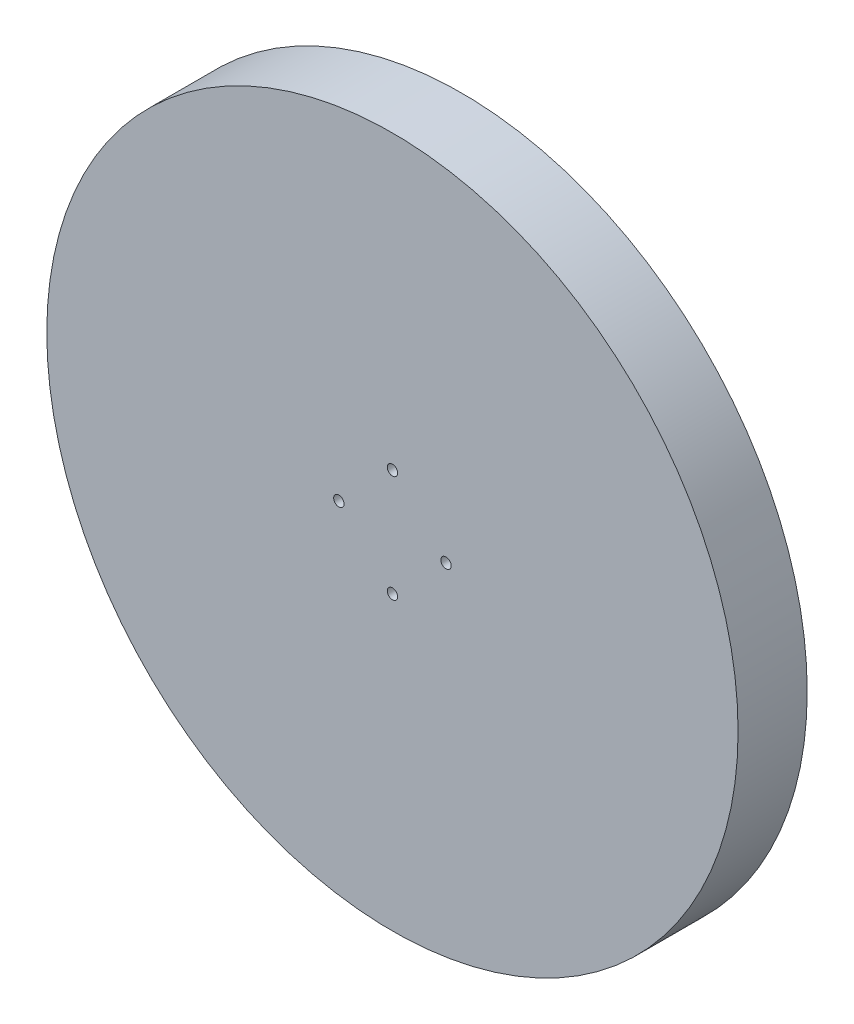
from build123d import *

# Parameters (mm, degrees)
SKETCH_1_R          = 100
EXTRUDE_1_DEPTH     = 20
SKETCH_2_R          = 1.5
CUT_EXTRUDE_1_DEPTH = 20


with BuildPart() as part:
    # 草图1 → 凸台-拉伸1 (new body)
    with BuildSketch(Plane.XY):
        Circle(SKETCH_1_R)
    extrude(amount=EXTRUDE_1_DEPTH)

    # 草图2 → 切除-拉伸1 (cut)
    with BuildSketch(Plane.XY.offset(20)):
        with Locations((0, 15.5)):
            Circle(SKETCH_2_R)
        with Locations((-15.5, 0)):
            Circle(SKETCH_2_R)
        with Locations((15.5, 0)):
            Circle(SKETCH_2_R)
        with Locations((0, -15.5)):
            Circle(SKETCH_2_R)
    extrude(amount=-CUT_EXTRUDE_1_DEPTH, mode=Mode.SUBTRACT)


solid = part.part
